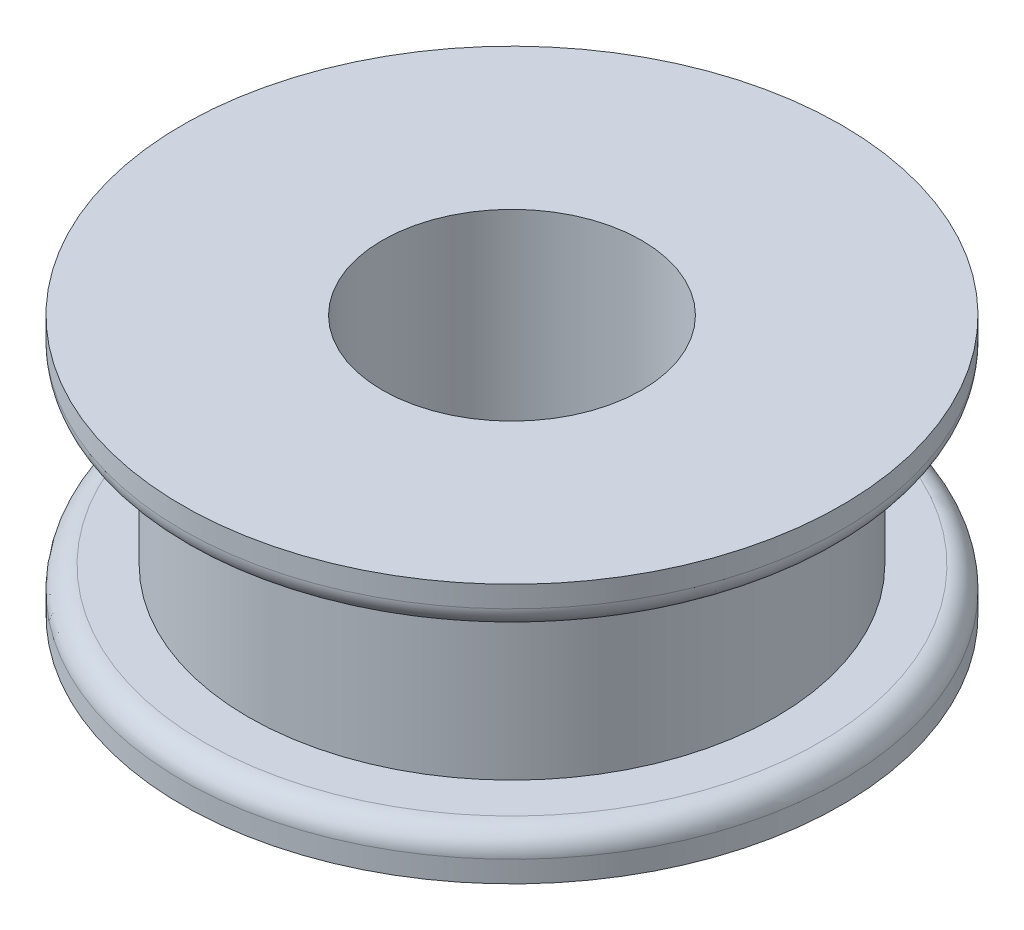
from build123d import *

# Parameters (mm, degrees)
FILLET1_R = 0.508


with BuildPart() as part:
    # Sketch1 → Revolve1 (revolve)
    with BuildSketch(Plane.YZ, mode=Mode.PRIVATE) as revolve1_sk:
        Polygon((0, 3.000000096), (-6.000000192, 3.000000096), (-6.000000192, 7.62), (-5.00000016, 7.62), (-5.00000016, 6.096), (-1.000000032, 6.096), (-1.000000032, 7.62), (0, 7.62), align=None)
    revolve(revolve1_sk.sketch.rotate(Axis((0, -39.041586513, 0), (0, 1, 0)), 180), axis=Axis((0, -39.041586513, 0), (0, 1, 0)))

    # Fillet1
    fillet1_edges = [part.edges().sort_by_distance(p)[0] for p in [
        (0, -1.000000032, 7.62),
        (0, -5.00000016, 7.62),
    ]]
    fillet(fillet1_edges, radius=FILLET1_R)


solid = part.part
